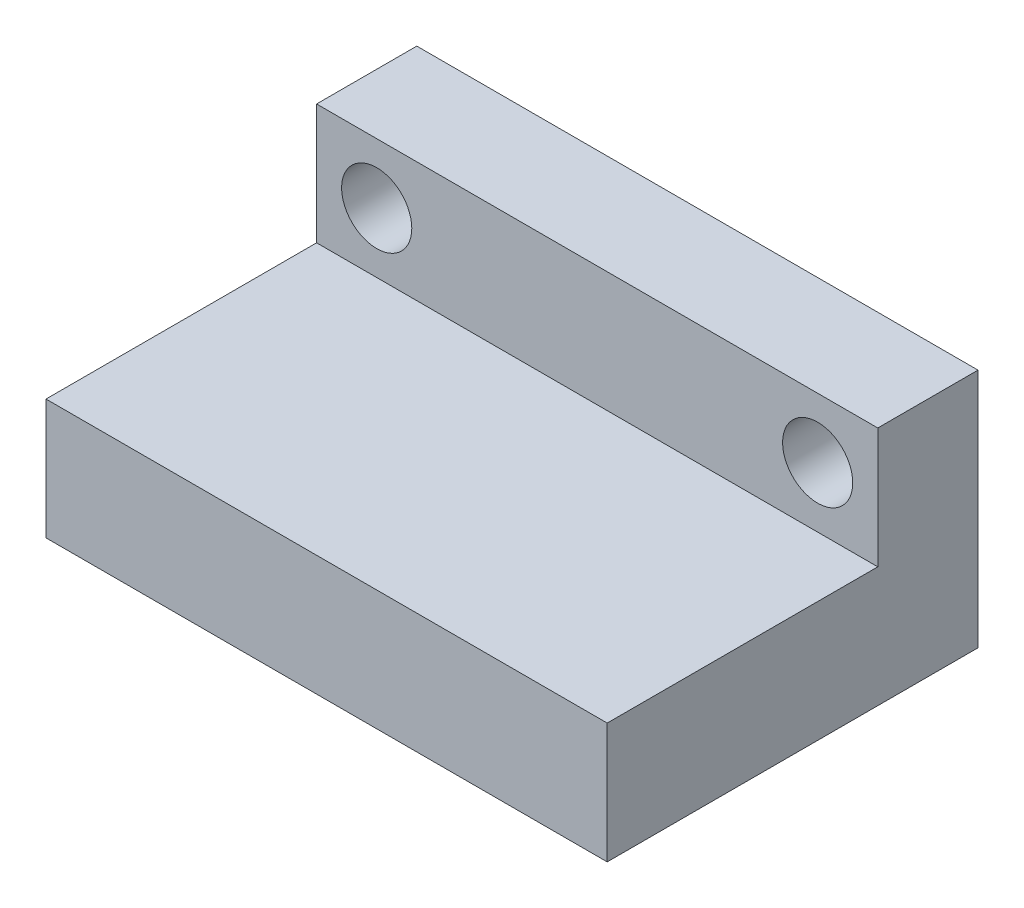
from build123d import *

# Parameters (mm, degrees)
SKETCH1_W           = 28
SKETCH1_H           = 12
BOSS_EXTRUDE1_DEPTH = 5
SKETCH2_W           = 28
SKETCH2_H           = 6
BOSS_EXTRUDE2_DEPTH = 13.5
SKETCH3_R           = 1.75
CUT_EXTRUDE1_DEPTH  = 21.353132437


with BuildPart() as part:
    # Sketch1 → Boss-Extrude1 (new body)
    with BuildSketch(Plane.XY):
        Rectangle(SKETCH1_W, SKETCH1_H)
    extrude(amount=BOSS_EXTRUDE1_DEPTH)

    # Sketch2 → Boss-Extrude2 (add)
    with BuildSketch(Plane.XY.offset(5)):
        with Locations((0, -3)):
            Rectangle(SKETCH2_W, SKETCH2_H)
    extrude(amount=BOSS_EXTRUDE2_DEPTH)

    # Sketch3 → Cut-Extrude1 (cut, through all)
    with BuildSketch(Plane.XY.offset(5)):
        with Locations((-11, 3)):
            Circle(SKETCH3_R)
        with Locations(Location((11, 3, 0), (0, 0, 180))):
            Circle(SKETCH3_R)
    extrude(amount=-CUT_EXTRUDE1_DEPTH, mode=Mode.SUBTRACT)


solid = part.part
